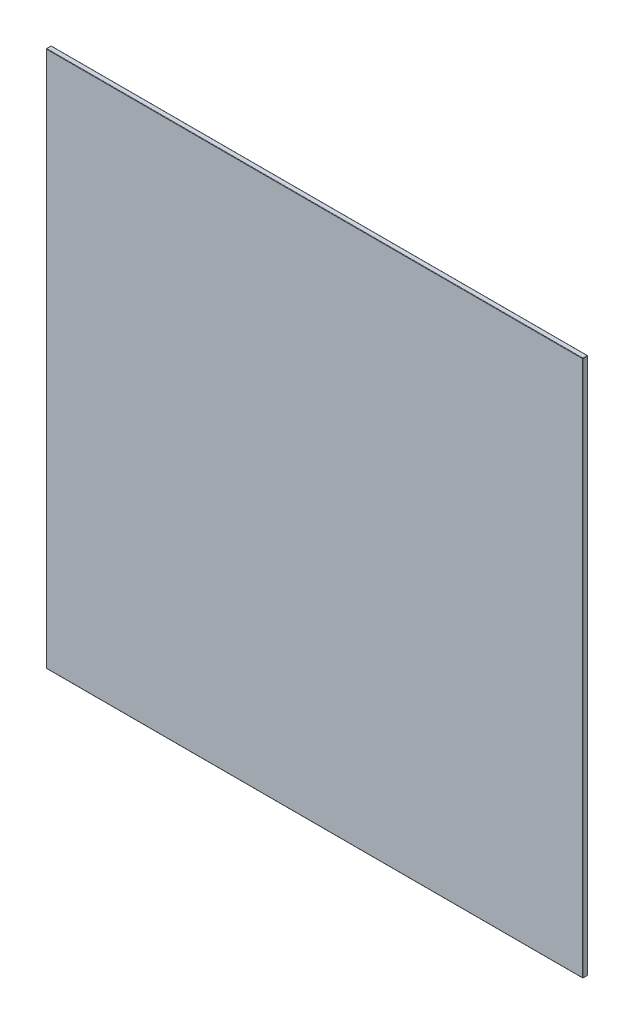
from build123d import *

# Parameters (mm, degrees)
SKETCH1_W           = 320
SKETCH1_H           = 320
BOSS_EXTRUDE1_DEPTH = 3
FILLET1_R           = 0.25


with BuildPart() as part:
    # Sketch1 → Boss-Extrude1 (new body)
    with BuildSketch(Plane.XY):
        Rectangle(SKETCH1_W, SKETCH1_H)
    extrude(amount=BOSS_EXTRUDE1_DEPTH)

    # Fillet1
    fillet1_edges = [part.edges().sort_by_distance(p)[0] for p in [
        (-160, 0, 3),
        (0, -160, 3),
        (160, 0, 3),
        (0, -160, 0),
        (-160, 0, 0),
        (0, 160, 0),
        (160, 0, 0),
        (0, 160, 3),
        (160, -160, 1.5),
        (-160, -160, 1.5),
        (-160, 160, 1.5),
        (160, 160, 1.5),
    ]]
    fillet(fillet1_edges, radius=FILLET1_R)


solid = part.part
